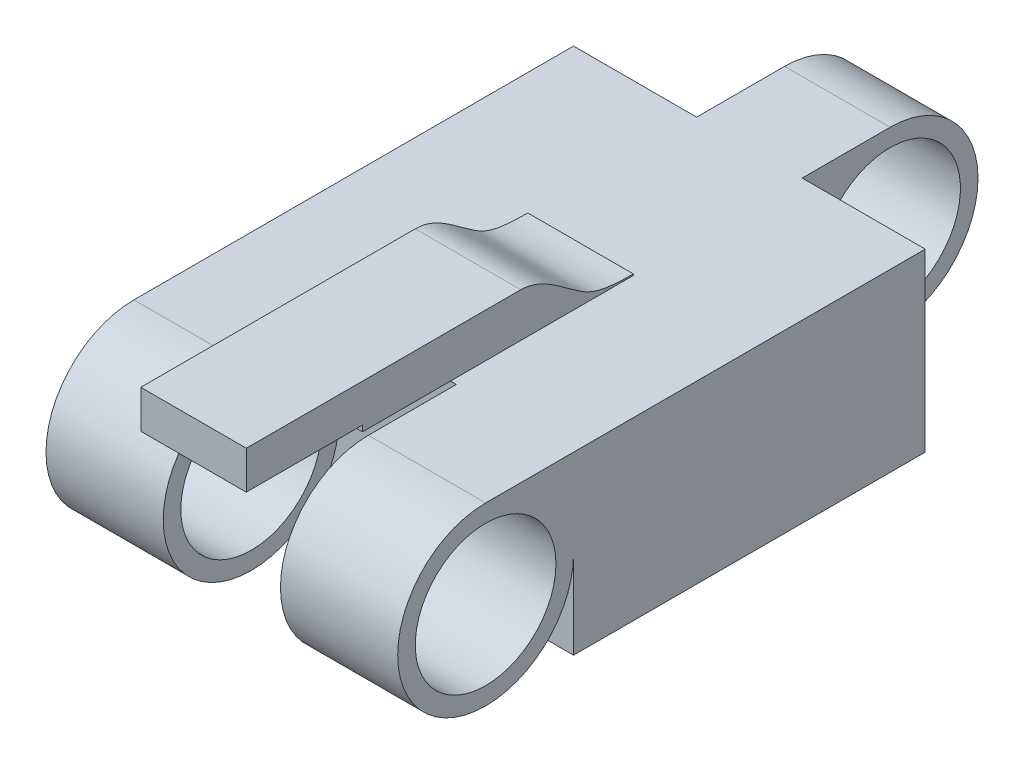
from build123d import *

# Parameters (mm, degrees)
SKETCH2_W                = 10
SKETCH2_H                = 5
BOSS_EXTRUDE1_DEPTH      = 10
SKETCH3_R                = 2
BOSS_EXTRUDE2_DEPTH      = 3.333333333
BOSS_EXTRUDE3_START      = -3.333333333
SKETCH4_R                = 2
BOSS_EXTRUDE3_DEPTH      = 3.333333333
BOSS_EXTRUDE4_DEPTH      = 1.5
BOSS_EXTRUDE4_DEPTH_BACK = 1.5
SKETCH6_R                = 2
BOSS_EXTRUDE5_DEPTH      = 1.5
BOSS_EXTRUDE5_DEPTH_BACK = 1.5
CUT_EXTRUDE1_DEPTH       = 18.501785659


with BuildPart() as part:
    # Sketch2 → Boss-Extrude1 (new body)
    with BuildSketch(Plane(origin=(0, 0, 0), x_dir=(0, 0, -1), z_dir=(1, 0, 0))):
        with Locations((5, 2.5)):
            Rectangle(SKETCH2_W, SKETCH2_H)
    extrude(amount=BOSS_EXTRUDE1_DEPTH)

    # Sketch3 → Boss-Extrude2 (add)
    with BuildSketch(Plane.ZY):
        with BuildLine():
            Line((2.5, 5), (0, 5))
            Line((0, 5), (0, 2.5))
            ThreePointArc((0, 2.5), (4.267766953, 0.732233047), (2.5, 5))
        make_face()
        with Locations((2.5, 2.5)):
            Circle(SKETCH3_R, mode=Mode.SUBTRACT)
    extrude(amount=-BOSS_EXTRUDE2_DEPTH)

    # Sketch4 → Boss-Extrude3 (add)
    with BuildSketch(Plane(origin=(10, 0, 0), x_dir=(0, 0, -1), z_dir=(1, 0, 0)).offset(BOSS_EXTRUDE3_START)):
        with BuildLine():
            Line((-2.5, 5), (0, 5))
            Line((0, 5), (0, 2.5))
            ThreePointArc((0, 2.5), (-4.267766953, 0.732233047), (-2.5, 5))
        make_face()
        with Locations(Location((-2.5, 2.5, 0), (0, 0, 180))):
            Circle(SKETCH4_R, mode=Mode.SUBTRACT)
    extrude(amount=BOSS_EXTRUDE3_DEPTH)

    # Sketch6 → Boss-Extrude4 (add, two sides: drawn at the far end of the back side and taken through both)
    with BuildSketch(Plane.ZY.offset(-5).offset(-BOSS_EXTRUDE4_DEPTH_BACK)):
        with BuildLine():
            Line((-12.5, 5), (-10, 5))
            Line((-10, 5), (-10, 2.5))
            ThreePointArc((-10, 2.5), (-14.267766953, 0.732233047), (-12.5, 5))
        make_face()
        with Locations((-12.5, 2.5)):
            Circle(SKETCH6_R, mode=Mode.SUBTRACT)
    extrude(amount=BOSS_EXTRUDE4_DEPTH + BOSS_EXTRUDE4_DEPTH_BACK)

    # Sketch8 → Boss-Extrude5 (add, two sides: drawn at the far end of the back side and taken through both)
    with BuildSketch(Plane.ZY.offset(-5).offset(-BOSS_EXTRUDE5_DEPTH_BACK)):
        with BuildLine():
            Line((0, 5), (-2, 5))
            Line((-2, 5), (-5.2, 5))
            Line((-5.2, 5), (-5.2, 5.04))
            add(Edge.make_bspline(
                [(-2, 6.25), (-2.494910157, 6.25), (-3.057241258, 5.810278687), (-3.866517232, 5.241546577), (-4.160995323, 5.04), (-5.2, 5.04)],
                knots=[0, 0, 0, 0, 0.415212535, 0.515212535, 1, 1, 1, 1], degree=3))
            Line((-2, 6.25), (8, 6.25))
            Line((8, 6.25), (8, 5))
            Line((8, 5), (0, 5))
        make_face()
    extrude(amount=BOSS_EXTRUDE5_DEPTH + BOSS_EXTRUDE5_DEPTH_BACK)

    # Sketch9 → Cut-Extrude1 (cut, through all)
    with BuildSketch(Plane.ZY.offset(-3.5)):
        Polygon((8, 6.25), (5.805296546, 6.25), (5.805296546, 5.167226788), (2.5, 5.167226788), (2.5, 5), (8, 5), align=None)
    extrude(amount=-CUT_EXTRUDE1_DEPTH, mode=Mode.SUBTRACT)


solid = part.part
